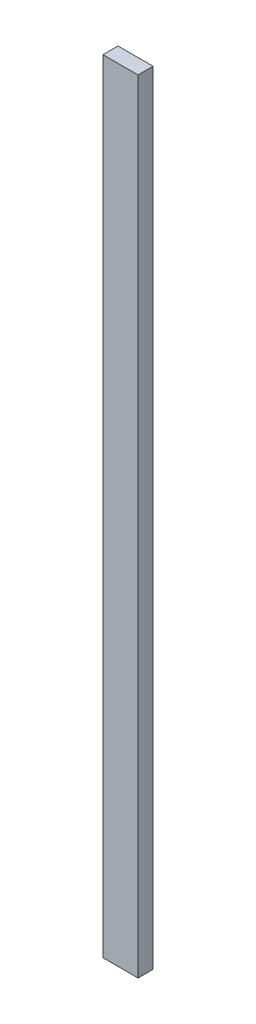
from build123d import *

# Parameters (mm, degrees)
SKETCH2_W           = 88.9
SKETCH2_H           = 38.1
BOSS_EXTRUDE1_DEPTH = 1981.2


with BuildPart() as part:
    # Sketch2 → Boss-Extrude1 (new body)
    with BuildSketch(Plane(origin=(0, 0, 0), x_dir=(1, 0, 0), z_dir=(0, 1, 0))):
        with Locations((44.45, 19.05)):
            Rectangle(SKETCH2_W, SKETCH2_H)
    extrude(amount=BOSS_EXTRUDE1_DEPTH)


solid = part.part
